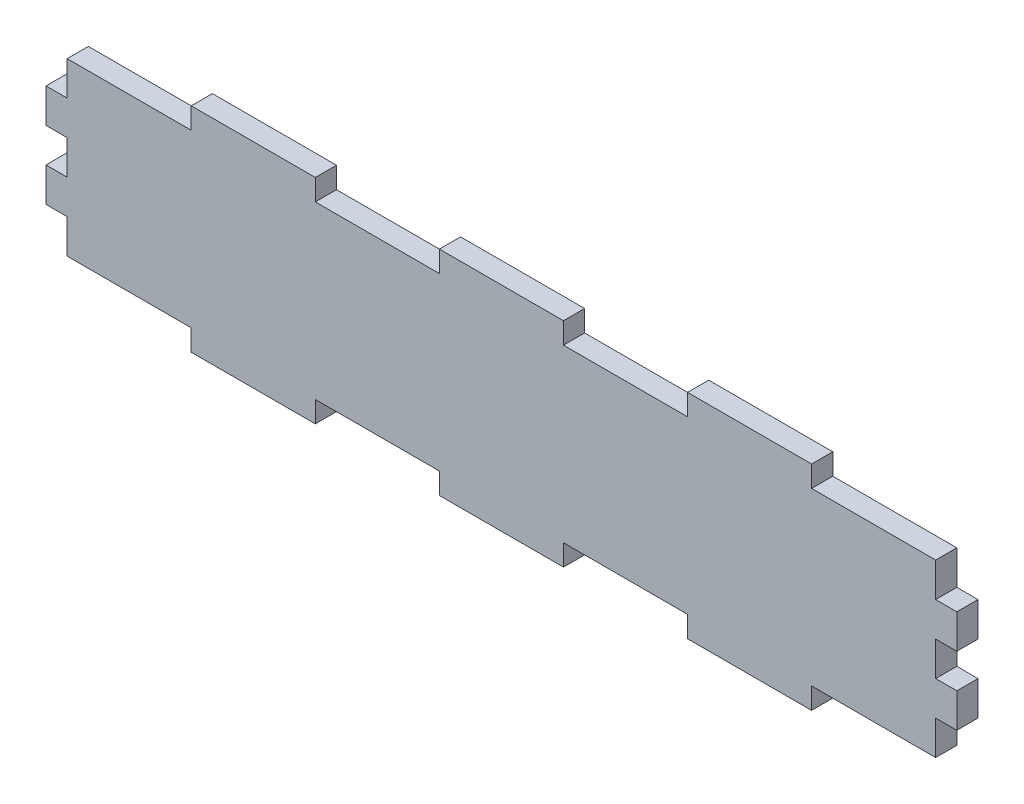
from build123d import *

# Parameters (mm, degrees)
BOSS_EXTRUDE1_DEPTH = 10


with BuildPart() as part:
    # Sketch2 → Boss-Extrude1 (new body)
    with BuildSketch(Plane.XY):
        Polygon((-205.1, 40.4), (-205.1, 24.24), (-215.1, 24.24), (-215.1, 8.08), (-205.1, 8.08), (-205.1, -8.08), (-215.1, -8.08), (-215.1, -24.24), (-205.1, -24.24), (-205.1, -40.4), (-146.5, -40.4), (-146.5, -50.4), (-87.9, -50.4), (-87.9, -40.4), (-29.3, -40.4), (-29.3, -50.4), (29.3, -50.4), (29.3, -40.4), (87.9, -40.4), (87.9, -50.4), (146.5, -50.4), (146.5, -40.4), (205.1, -40.4), (205.1, -24.24), (215.1, -24.24), (215.1, -8.08), (205.1, -8.08), (205.1, 8.08), (215.1, 8.08), (215.1, 24.24), (205.1, 24.24), (205.1, 40.4), (146.5, 40.4), (146.5, 50.4), (87.9, 50.4), (87.9, 40.4), (29.3, 40.4), (29.3, 50.4), (-29.3, 50.4), (-29.3, 40.4), (-87.9, 40.4), (-87.9, 50.4), (-146.5, 50.4), (-146.5, 40.4), align=None)
    extrude(amount=BOSS_EXTRUDE1_DEPTH)


solid = part.part
